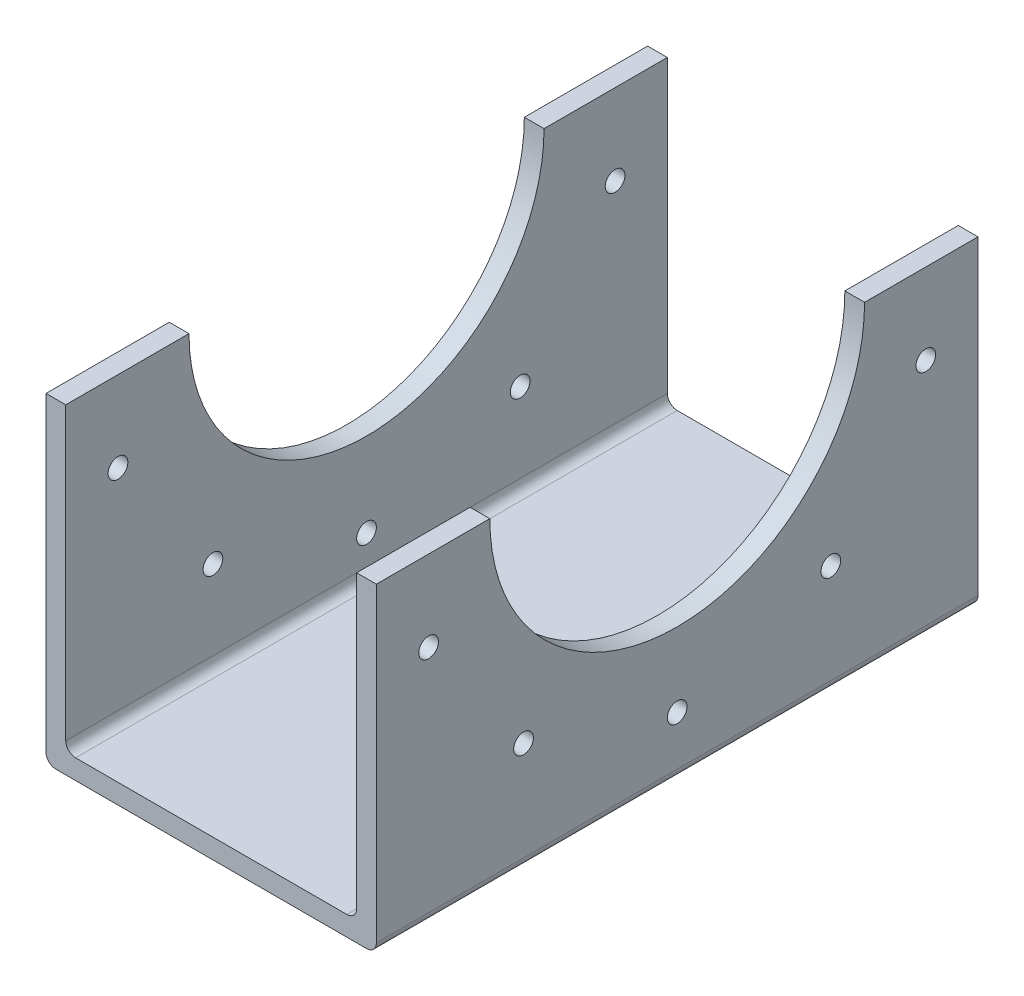
from build123d import *

# Parameters (mm, degrees)
SKETCH_1_W          = 67
SKETCH_1_H          = 122
EXTRUDE_1_DEPTH     = 4
SKETCH_2_W          = 4
SKETCH_2_H          = 122
EXTRUDE_2_DEPTH     = 61
FILLET_1_R          = 2
SKETCH_4_R          = 38
SKETCH_4_R_2        = 2
CUT_EXTRUDE_1_DEPTH = 11
CUT_EXTRUDE_START   = -11
SKETCH_5_R          = 36
SKETCH_5_R_2        = 2
CUT_EXTRUDE_2_DEPTH = 11


with BuildPart() as part:
    # Эскиз1 → Бобышка-Вытянуть1 (new body)
    with BuildSketch(Plane(origin=(0, 0, 0), x_dir=(1, 0, 0), z_dir=(0, 1, 0))):
        Rectangle(SKETCH_1_W, SKETCH_1_H)
    extrude(amount=EXTRUDE_1_DEPTH)

    # Эскиз2 → Бобышка-Вытянуть2 (add)
    with BuildSketch(Plane(origin=(0, 4, 0), x_dir=(1, 0, 0), z_dir=(0, 1, 0))):
        with Locations((-31.5, 0)):
            Rectangle(SKETCH_2_W, SKETCH_2_H)
        with Locations((31.5, 0)):
            Rectangle(SKETCH_2_W, SKETCH_2_H)
    extrude(amount=EXTRUDE_2_DEPTH)

    # Скругление1
    fillet_1_edges = [part.edges().sort_by_distance(p)[0] for p in [
        (-29.5, 4, 0),
        (29.5, 4, 0),
        (33.5, 0, 0),
        (-33.5, 0, 0),
    ]]
    fillet(fillet_1_edges, radius=FILLET_1_R)

    # Эскиз4 → Вырез-Вытянуть1 (cut)
    with BuildSketch(Plane(origin=(33.5, 0, 0), x_dir=(0, 0, -1), z_dir=(1, 0, 0))):
        with Locations((0, 65)):
            Circle(SKETCH_4_R)
        with Locations((0, 12)):
            Circle(SKETCH_4_R_2)
        with Locations((-31.152618372, 22.122099298)):
            Circle(SKETCH_4_R_2)
        with Locations((-50.405995364, 48.622099298)):
            Circle(SKETCH_4_R_2)
        with Locations((50.405995364, 48.622099298)):
            Circle(SKETCH_4_R_2)
        with Locations((31.152618372, 22.122099298)):
            Circle(SKETCH_4_R_2)
    extrude(amount=-CUT_EXTRUDE_1_DEPTH, mode=Mode.SUBTRACT)

    # Эскиз5 → Вырез-Вытянуть2 (cut)
    with BuildSketch(Plane.ZY.offset(33.5).offset(CUT_EXTRUDE_START)):
        with Locations((0, 65)):
            Circle(SKETCH_5_R)
        with Locations(Location((0, 12, 0), (0, 0, 180))):
            Circle(SKETCH_5_R_2)
        with Locations(Location((-31.152618372, 22.122099298, 0), (0, 0, 180))):
            Circle(SKETCH_5_R_2)
        with Locations(Location((-50.405995364, 48.622099298, 0), (0, 0, 180))):
            Circle(SKETCH_5_R_2)
        with Locations(Location((50.405995364, 48.622099298, 0), (0, 0, 180))):
            Circle(SKETCH_5_R_2)
        with Locations(Location((31.152618372, 22.122099298, 0), (0, 0, 180))):
            Circle(SKETCH_5_R_2)
    extrude(amount=CUT_EXTRUDE_2_DEPTH, mode=Mode.SUBTRACT)


solid = part.part
